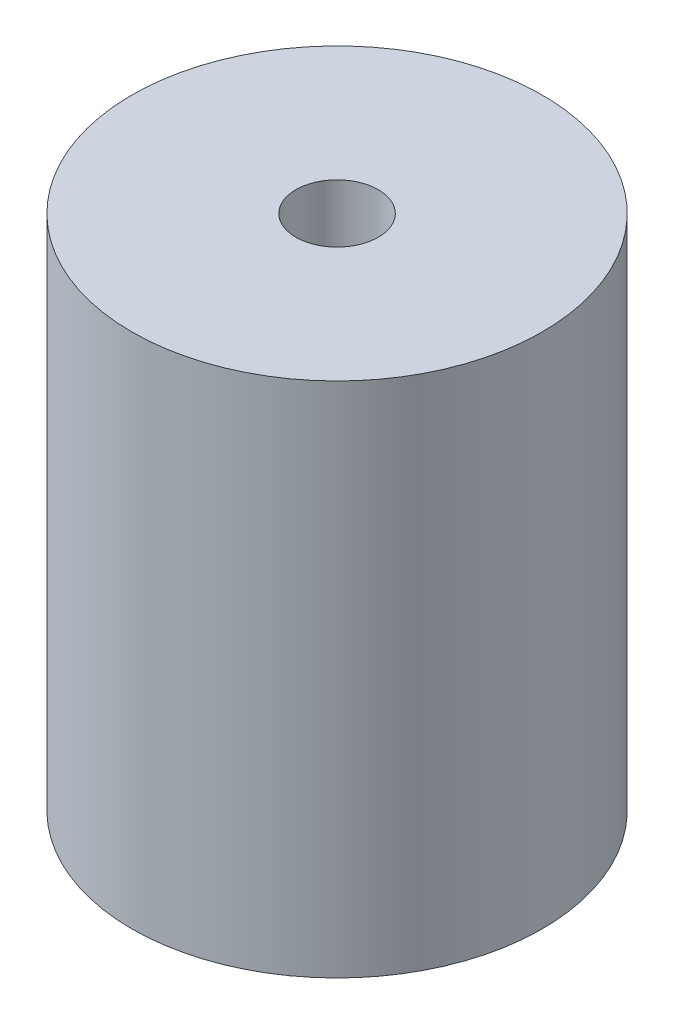
from build123d import *

# Parameters (mm, degrees)
SKETCH1_R                       = 12.7
BOSS_EXTRUDE1_DEPTH             = 32
TAP_DRILL_FOR_1_4_20_TAP1_D     = 5.1054
TAP_DRILL_FOR_1_4_20_TAP1_DEPTH = 7.62
TAP_DRILL_FOR_1_4_20_TAP1_TIP   = 1.533816902
TAP_DRILL_FOR_1_4_20_TAP2_D     = 5.1054
TAP_DRILL_FOR_1_4_20_TAP2_DEPTH = 7.62
TAP_DRILL_FOR_1_4_20_TAP2_TIP   = 1.533816902


with BuildPart() as part:
    # Sketch1 → Boss-Extrude1 (new body)
    with BuildSketch(Plane(origin=(0, 0, 0), x_dir=(1, 0, 0), z_dir=(0, 1, 0))):
        with Locations(Location((0, 0, 0), (0, 0, 270))):
            Circle(SKETCH1_R)
    extrude(amount=BOSS_EXTRUDE1_DEPTH)

    # Tap Drill for 1/4-20 Tap1
    with Locations(Plane.XZ):
        with Locations((0, 0)):
            Hole(TAP_DRILL_FOR_1_4_20_TAP1_D / 2, depth=TAP_DRILL_FOR_1_4_20_TAP1_DEPTH)
            with Locations((0, 0, -(TAP_DRILL_FOR_1_4_20_TAP1_DEPTH + TAP_DRILL_FOR_1_4_20_TAP1_TIP / 2))):  # 118° drill point
                Cone(0, TAP_DRILL_FOR_1_4_20_TAP1_D / 2, TAP_DRILL_FOR_1_4_20_TAP1_TIP, mode=Mode.SUBTRACT)

    # Tap Drill for 1/4-20 Tap2
    with Locations(Plane(origin=(0, 32, 0), x_dir=(1, 0, 0), z_dir=(0, 1, 0))):
        with Locations((0, 0)):
            Hole(TAP_DRILL_FOR_1_4_20_TAP2_D / 2, depth=TAP_DRILL_FOR_1_4_20_TAP2_DEPTH)
            with Locations((0, 0, -(TAP_DRILL_FOR_1_4_20_TAP2_DEPTH + TAP_DRILL_FOR_1_4_20_TAP2_TIP / 2))):  # 118° drill point
                Cone(0, TAP_DRILL_FOR_1_4_20_TAP2_D / 2, TAP_DRILL_FOR_1_4_20_TAP2_TIP, mode=Mode.SUBTRACT)


solid = part.part
